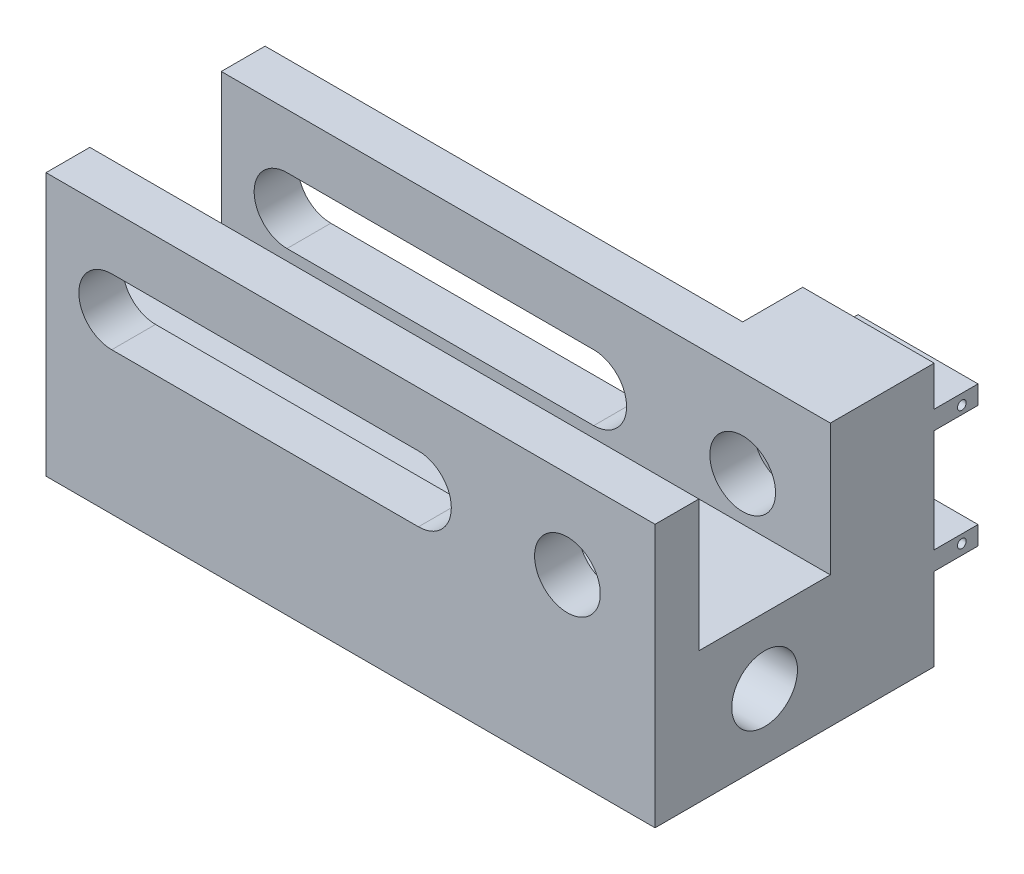
from build123d import *

# Parameters (mm, degrees)
BOSS_EXTRUDE1_DEPTH     = 139
SKETCH3_R               = 7.5
CUT_EXTRUDE1_DEPTH      = 160.439643753
CUT_EXTRUDE2_DEPTH      = 154.447059275
CUT_EXTRUDE2_DEPTH_BACK = 154.447059275
SKETCH4_R               = 7.5
SKETCH5_W               = 30
SKETCH5_H               = 60
BOSS_EXTRUDE2_DEPTH     = 13.7
SKETCH6_W               = 27.582278357
SKETCH6_H               = 4.25
SKETCH6_W_2             = 27.382278357
BOSS_EXTRUDE3_DEPTH     = 10
CUT_EXTRUDE3_DEPTH      = 136.757894005
CUT_EXTRUDE3_DEPTH_BACK = 136.757894005
SKETCH7_R               = 1


with BuildPart() as part:
    # Sketch2 → Boss-Extrude1 (new body)
    with BuildSketch(Plane(origin=(0, 0, 0), x_dir=(0, 0, -1), z_dir=(1, 0, 0))):
        Polygon((-15, 30), (15, 30), (15, 60), (25, 60), (25, 51.134717436), (25, 0), (-25, 0), (-25, 60), (-15, 60), align=None)
    extrude(amount=BOSS_EXTRUDE1_DEPTH)

    # Sketch3 → Cut-Extrude1 (cut, through all)
    with BuildSketch(Plane(origin=(0, 0, -25), x_dir=(-1, 0, 0), z_dir=(0, 0, -1))):
        with Locations((-119, 40)):
            Circle(SKETCH3_R)
        with BuildLine():
            Line((-85, 47.5), (-15, 47.5))
            ThreePointArc((-15, 47.5), (-7.5, 40), (-15, 32.5))
            Line((-15, 32.5), (-85, 32.5))
            ThreePointArc((-85, 32.5), (-92.5, 40), (-85, 47.5))
        make_face()
    extrude(amount=-CUT_EXTRUDE1_DEPTH, mode=Mode.SUBTRACT)

    # Sketch4 → Cut-Extrude2 (cut, two sides: drawn at the far end of the back side and taken through both)
    with BuildSketch(Plane(origin=(139, 0, 0), x_dir=(0, 0, -1), z_dir=(1, 0, 0)).offset(-CUT_EXTRUDE2_DEPTH_BACK)):
        with Locations((0, 15)):
            Circle(SKETCH4_R)
    extrude(amount=CUT_EXTRUDE2_DEPTH + CUT_EXTRUDE2_DEPTH_BACK, mode=Mode.SUBTRACT)

    # Sketch5 → Boss-Extrude2 (add)
    with BuildSketch(Plane(origin=(0, 0, -25), x_dir=(-1, 0, 0), z_dir=(0, 0, -1))):
        with Locations((-124, 30)):
            Rectangle(SKETCH5_W, SKETCH5_H)
    extrude(amount=BOSS_EXTRUDE2_DEPTH)

    # Sketch6 → Boss-Extrude3 (add)
    with BuildSketch(Plane(origin=(0, 0, -38.7), x_dir=(-1, 0, 0), z_dir=(0, 0, -1))):
        with Locations((-125.208860821, 20.975)):
            Rectangle(SKETCH6_W, SKETCH6_H)
        with Locations((-125.308860822, 48.775)):
            Rectangle(SKETCH6_W_2, SKETCH6_H)
    extrude(amount=BOSS_EXTRUDE3_DEPTH)

    # Sketch7 → Cut-Extrude3 (cut, two sides: drawn at the far end of the back side and taken through both)
    with BuildSketch(Plane.ZY.offset(-111.617721643).offset(-CUT_EXTRUDE3_DEPTH_BACK)):
        with Locations((-45.013158899, 48.529439721)):
            Circle(SKETCH7_R)
        with Locations((-45.013158899, 21.190661747)):
            Circle(SKETCH7_R)
    extrude(amount=CUT_EXTRUDE3_DEPTH + CUT_EXTRUDE3_DEPTH_BACK, mode=Mode.SUBTRACT)


solid = part.part
